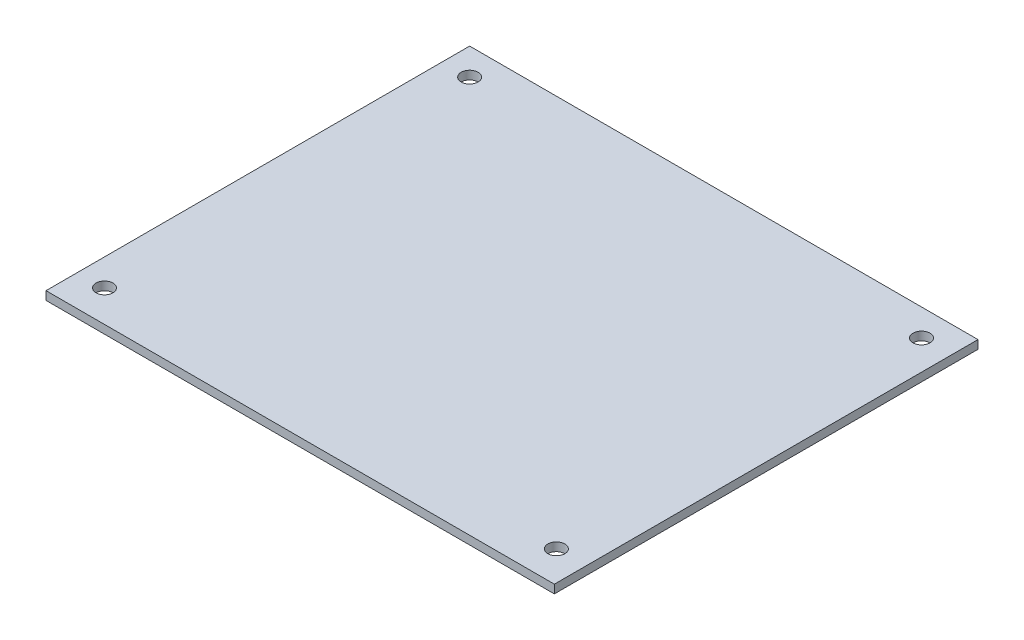
from build123d import *

# Parameters (mm, degrees)
SKETCH1_W           = 96
SKETCH1_H           = 80
SKETCH1_R           = 1.6
BOSS_EXTRUDE1_DEPTH = 1.6


with BuildPart() as part:
    # Sketch1 → Boss-Extrude1 (new body)
    with BuildSketch(Plane(origin=(0, 0, 0), x_dir=(1, 0, 0), z_dir=(0, 1, 0))):
        with Locations((48, 40)):
            Rectangle(SKETCH1_W, SKETCH1_H)
        with Locations(Location((5.08, 74.92, 0), (0, 0, 270))):
            Circle(SKETCH1_R, mode=Mode.SUBTRACT)
        with Locations(Location((90.412, 74.92, 0), (0, 0, 270))):
            Circle(SKETCH1_R, mode=Mode.SUBTRACT)
        with Locations(Location((90.412, 5.969, 0), (0, 0, 270))):
            Circle(SKETCH1_R, mode=Mode.SUBTRACT)
        with Locations(Location((5.08, 5.969, 0), (0, 0, 270))):
            Circle(SKETCH1_R, mode=Mode.SUBTRACT)
    extrude(amount=BOSS_EXTRUDE1_DEPTH)


solid = part.part
